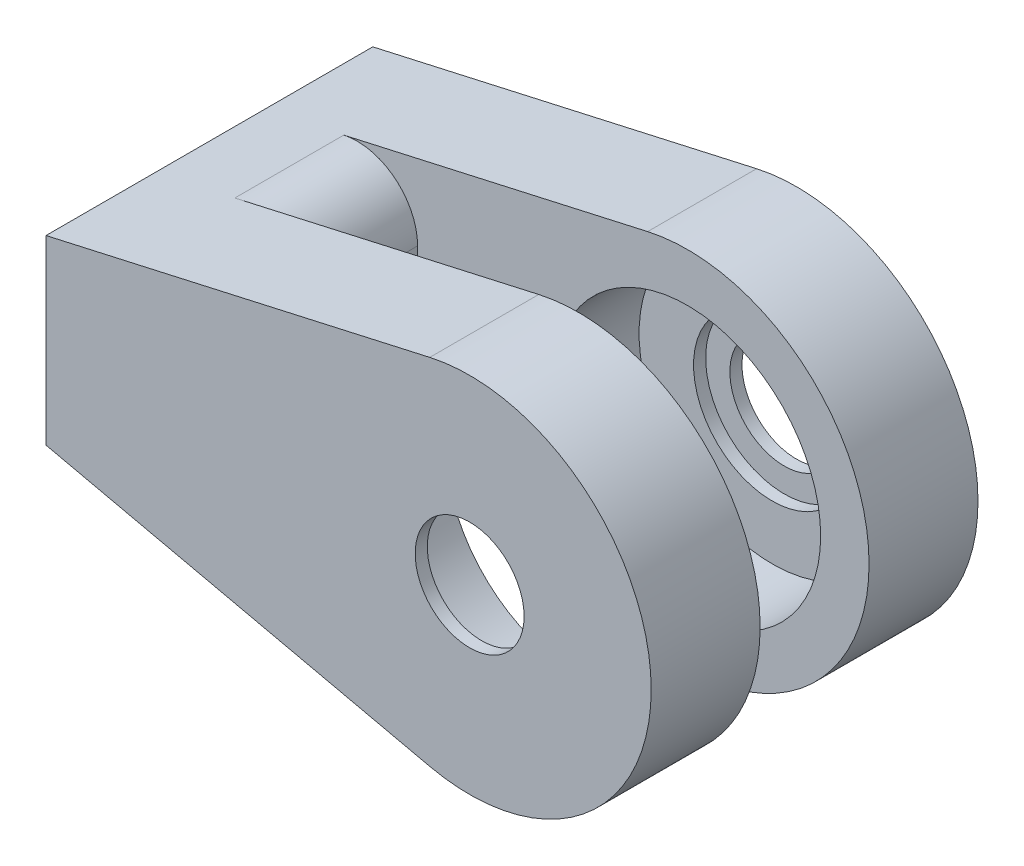
from build123d import *

# Parameters (mm, degrees)
SKETCH1_R               = 15
BOSS_EXTRUDE1_DEPTH     = 9
SKETCH2_R               = 11
CUT_EXTRUDE1_DEPTH      = 7
CUT_EXTRUDE2_REACH      = 40.717
SKETCH3_R               = 4.5
BOSS_EXTRUDE3_REACH     = 44.119
SKETCH6_R               = 5.031250000000002
CUT_EXTRUDE3_DEPTH      = 11.43
FILLET1_R               = 5
CUT_EXTRUDE4_DEPTH      = 1
CUT_EXTRUDE4_DEPTH_BACK = 24
SKETCH7_R               = 6.5


with BuildPart() as part:
    # Sketch1 → Boss-Extrude1 (new body)
    with BuildSketch(Plane.XY):
        with BuildLine():
            ThreePointArc((-3.2926829268292646, -14.634146341463415), (-15, 1.84e-15), (-3.2926829268292708, 14.634146341463413))
            Line((-3.2926829268292703, 14.634146341463419), (-35.00000000000001, 7.499999999999995))
            Line((-35.00000000000001, 7.499999999999995), (-35, -7.500000000000005))
            Line((-35, -7.500000000000005), (-3.292682926829265, -14.634146341463415))
        make_face()
        Circle(SKETCH1_R)
    extrude(amount=BOSS_EXTRUDE1_DEPTH)

    # Sketch2 → Cut-Extrude1 (cut)
    with BuildSketch(Plane.XY.offset(9)):
        Circle(SKETCH2_R)
    extrude(amount=-CUT_EXTRUDE1_DEPTH, mode=Mode.SUBTRACT)

    # Sketch3 → Cut-Extrude2 (cut, up to next)
    with BuildSketch(Plane.XY.offset(2), mode=Mode.PRIVATE) as cut_extrude2_sk1:
        Circle(SKETCH3_R)
    cut_extrude2_tool1 = extrude(cut_extrude2_sk1.sketch, amount=-CUT_EXTRUDE2_REACH, mode=Mode.PRIVATE) & part.part
    add(cut_extrude2_tool1.solids().sort_by_distance((0, 0, 2))[0], mode=Mode.SUBTRACT)


with BuildPart() as body_2:
    # Mirror8: mirrored copy
    add(part.part.mirror(Plane.XY.offset(13.499999999999998)))

    # Sketch4 → Boss-Extrude3 (add, up to next)
    with BuildSketch(Plane.XY.offset(9), mode=Mode.PRIVATE) as boss_extrude3_sk1:
        Polygon((-35.00000000000001, 7.499999999999995), (-35.00000000000001, -7.500000000000005), (-22.300000000000008, -10.357500000000002), (-22.300000000000015, 10.357499999999998), align=None)
    boss_extrude3_tool1 = extrude(boss_extrude3_sk1.sketch, amount=BOSS_EXTRUDE3_REACH, mode=Mode.PRIVATE) - body_2.part

    add(part.part)  # Boss-Extrude3 merges part
    add(boss_extrude3_tool1.solids().sort_by_distance((-28.311298, 0, 9))[0])

    # Sketch6 → Cut-Extrude3 (cut)
    with BuildSketch(Plane.ZY.offset(35.00000000000001)):
        with Locations((13.499999999999998, -3.47e-15)):
            Circle(SKETCH6_R)
    extrude(amount=-CUT_EXTRUDE3_DEPTH, mode=Mode.SUBTRACT)

    # Fillet1
    fillet1_edges = [body_2.edges().sort_by_distance(p)[0] for p in [
        (-22.300000000000015, 10.357499999999996, 13.499999999999998),
        (-22.300000000000008, -10.3575, 13.499999999999998),
    ]]
    fillet(fillet1_edges, radius=FILLET1_R)

    # Sketch7 → Cut-Extrude4 (cut, two sides: drawn at the far end of the back side and taken through both)
    with BuildSketch(Plane.XY.offset(24.999999999999993).offset(-CUT_EXTRUDE4_DEPTH_BACK)):
        Circle(SKETCH7_R)
    extrude(amount=CUT_EXTRUDE4_DEPTH + CUT_EXTRUDE4_DEPTH_BACK, mode=Mode.SUBTRACT)


solid = body_2.part
